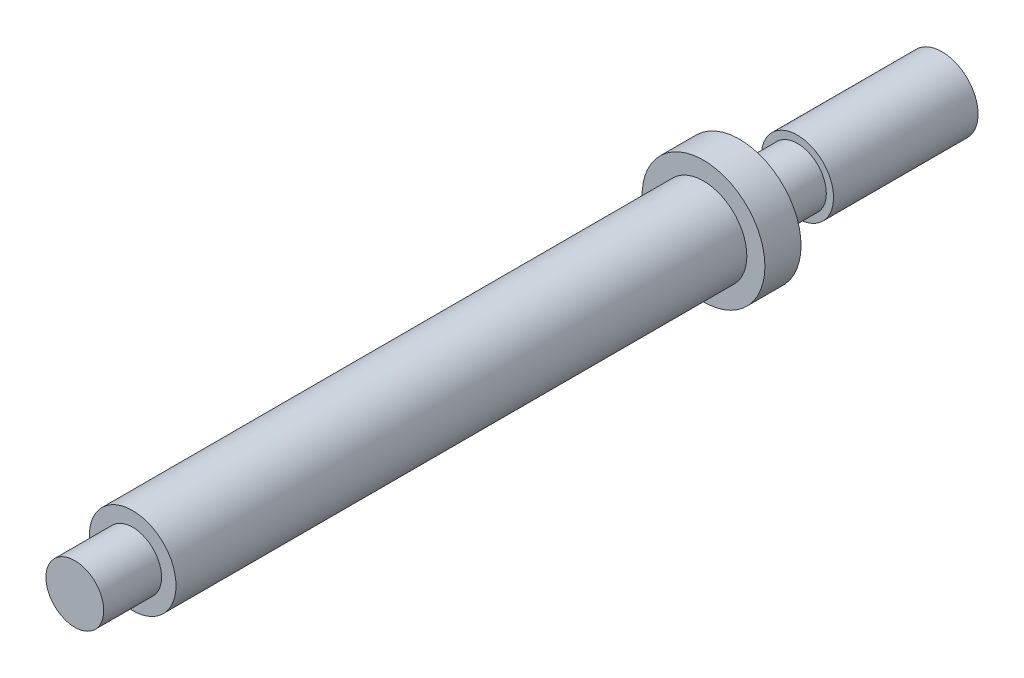
from build123d import *

# Parameters (mm, degrees)
SKETCH3_R           = 5
BOSS_EXTRUDE1_DEPTH = 20


with BuildPart() as part:
    # Sketch2 → Revolve1 (revolve)
    with BuildSketch(Plane(origin=(0, 0, 0), x_dir=(0, 0, -1), z_dir=(1, 0, 0)), mode=Mode.PRIVATE) as revolve1_sk:
        Polygon((0, 0), (0, 4), (8, 4), (8, 6), (87, 6), (87, 8.5), (92, 8.5), (92, 4), (100, 4), (100, 0), align=None)
    revolve(revolve1_sk.sketch.rotate(Axis((0, 0, 0), (0, 0, -1)), 90), axis=Axis((0, 0, 0), (0, 0, -1)))

    # Sketch3 → Boss-Extrude1 (add)
    with BuildSketch(Plane(origin=(0, 0, -100), x_dir=(-1, 0, 0), z_dir=(0, 0, -1))):
        Circle(SKETCH3_R)
    extrude(amount=BOSS_EXTRUDE1_DEPTH)


solid = part.part
